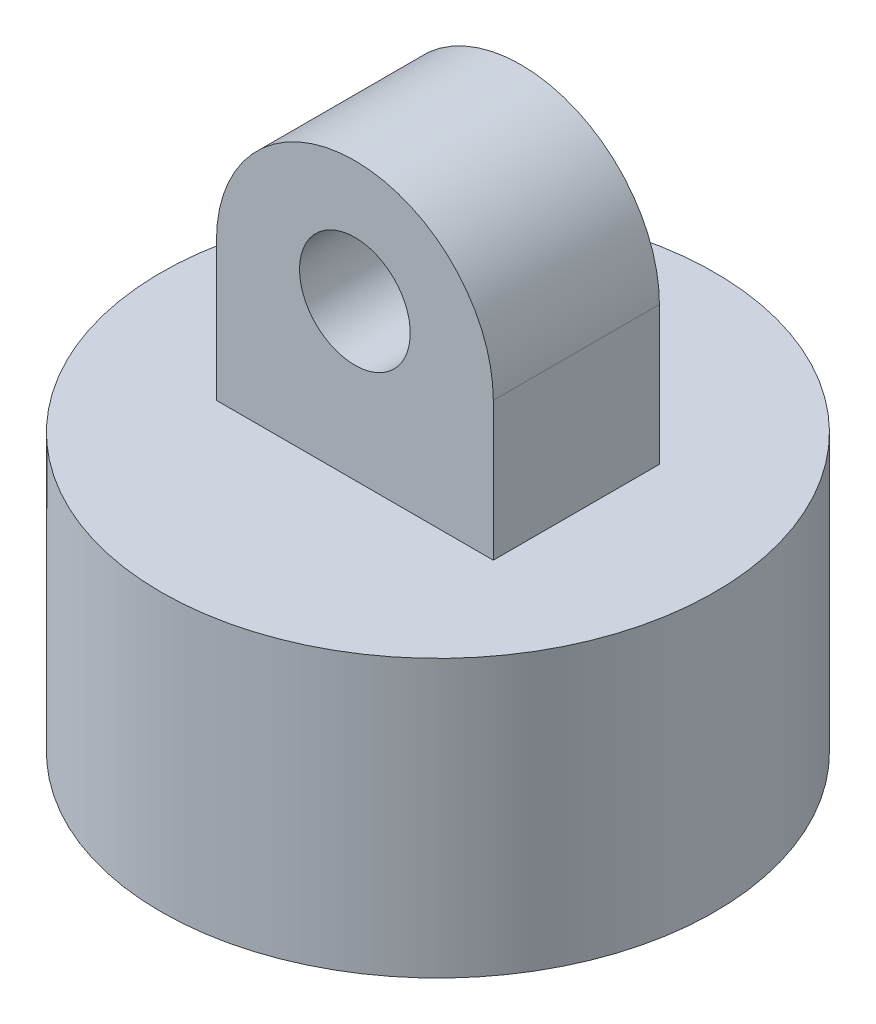
from build123d import *

# Parameters (mm, degrees)
CROQUIS1_R              = 50
SALIENTE_EXTRUIR1_DEPTH = 50
CROQUIS2_W              = 50
CROQUIS2_H              = 30
SALIENTE_EXTRUIR2_DEPTH = 50
CROQUIS3_R              = 10
CORTAR_EXTRUIR1_DEPTH   = 30
REDONDEO1_RADIUS        = 25
REDONDEO1_LENGTH        = 30


with BuildPart() as part:
    # Croquis1 → Saliente-Extruir1 (new body)
    with BuildSketch(Plane(origin=(0, 0, 0), x_dir=(1, 0, 0), z_dir=(0, 1, 0))):
        with Locations(Location((0, 0, 0), (0, 0, 270))):
            Circle(CROQUIS1_R)
    extrude(amount=SALIENTE_EXTRUIR1_DEPTH)

    # Croquis2 → Saliente-Extruir2 (add)
    with BuildSketch(Plane(origin=(0, 50, 0), x_dir=(1, 0, 0), z_dir=(0, 1, 0))):
        Rectangle(CROQUIS2_W, CROQUIS2_H)
    extrude(amount=SALIENTE_EXTRUIR2_DEPTH)

    # Croquis3 → Cortar-Extruir1 (cut)
    with BuildSketch(Plane(origin=(0, 0, -15), x_dir=(-1, 0, 0), z_dir=(0, 0, -1))):
        with Locations((0, 78)):
            Circle(CROQUIS3_R)
    extrude(amount=-CORTAR_EXTRUIR1_DEPTH, mode=Mode.SUBTRACT)

    # Redondeo1: full round fillet: the end face becomes a half cylinder, R = half its width
    redondeo1_face = Plane((0, 100, 0), x_dir=(0, 0, 1), z_dir=(0, 1, 0))  # on the end face: x along it, z out of the body
    redondeo1_slab = redondeo1_face.offset(-REDONDEO1_RADIUS / 2) * Box(REDONDEO1_LENGTH, 2 * REDONDEO1_RADIUS, REDONDEO1_RADIUS, mode=Mode.PRIVATE)  # the body's end, R deep
    redondeo1_round = Plane((0, 75, 0), x_dir=(0, 1, 0), z_dir=(0, 0, 1)) * Cylinder(REDONDEO1_RADIUS, REDONDEO1_LENGTH, mode=Mode.PRIVATE)  # its axis R under the face
    add(redondeo1_slab - redondeo1_round, mode=Mode.SUBTRACT)


solid = part.part
